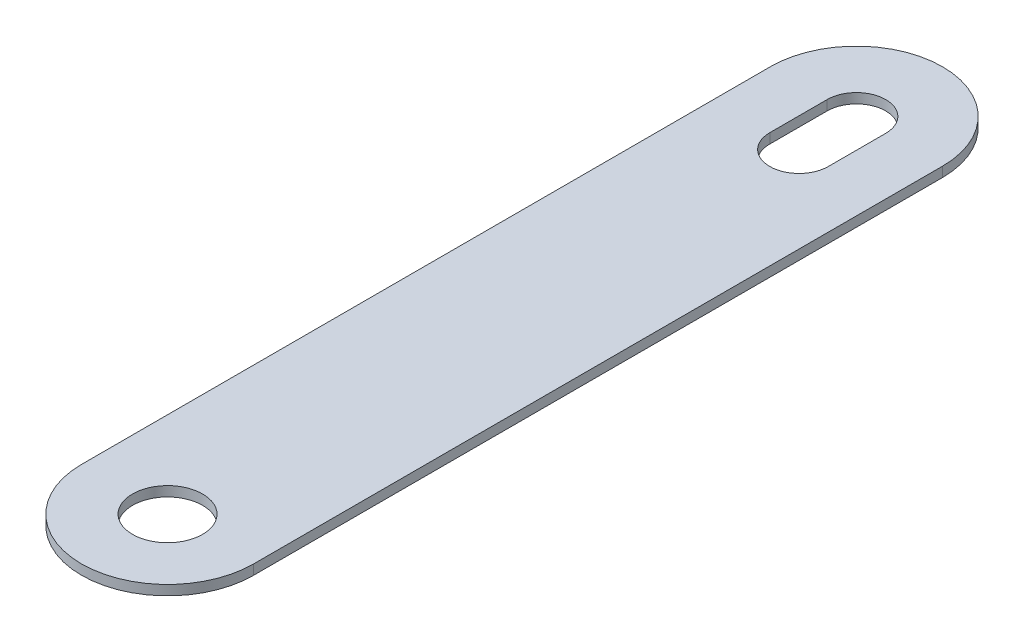
from build123d import *

# Parameters (mm, degrees)
SKETCH1_R           = 3.05
BOSS_EXTRUDE1_DEPTH = 0.86


with BuildPart() as part:
    # Sketch1 → Boss-Extrude1 (new body)
    with BuildSketch(Plane(origin=(0, 0, 0), x_dir=(1, 0, 0), z_dir=(0, 1, 0))):
        with BuildLine():
            Line((-7.5, 0), (-7.5, 60))
            ThreePointArc((-7.5, 60), (0, 67.5), (7.5, 60))
            Line((7.5, 60), (7.5, 0))
            ThreePointArc((7.5, 0), (0, -7.5), (-7.5, 0))
        make_face()
        with Locations(Location((0, 0, 0), (0, 0, 270))):
            Circle(SKETCH1_R, mode=Mode.SUBTRACT)
        with BuildLine():
            Line((2.55, 60), (2.55, 55))
            ThreePointArc((2.55, 55), (0, 52.45), (-2.55, 55))
            Line((-2.55, 55), (-2.55, 60))
            ThreePointArc((-2.55, 60), (0, 62.55), (2.55, 60))
        make_face(mode=Mode.SUBTRACT)
    extrude(amount=BOSS_EXTRUDE1_DEPTH)


solid = part.part
